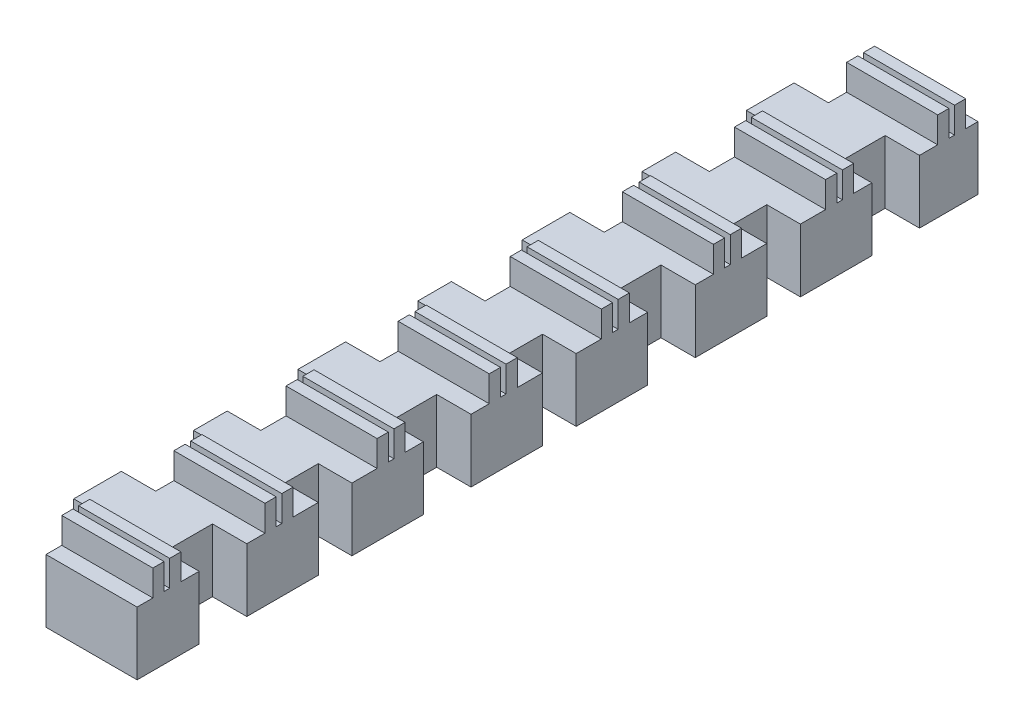
from build123d import *

# Parameters (mm, degrees)
SKETCH1_W           = 13
SKETCH1_H           = 120
BOSS_EXTRUDE1_DEPTH = 9
SKETCH2_W           = 4.9
SKETCH2_H           = 6.8
BOSS_EXTRUDE2_DEPTH = 9
LPATTERN1_COUNT     = 4
LPATTERN1_PITCH     = 32
SKETCH3_W           = 4.8
SKETCH3_H           = 4.8
BOSS_EXTRUDE3_DEPTH = 9
LPATTERN2_COUNT     = 3
LPATTERN2_PITCH     = 32
SKETCH4_R           = 1.5
CUT_EXTRUDE1_DEPTH  = 9.6
CUT_EXTRUDE2_START  = -9.6
SKETCH5_R           = 1.5
CUT_EXTRUDE2_DEPTH  = 9.6
SKETCH6_W           = 13
SKETCH6_H           = 1.6
BOSS_EXTRUDE4_DEPTH = 3.7
LPATTERN3_COUNT     = 8
LPATTERN3_PITCH     = 16
SKETCH7_W           = 4.9
SKETCH7_H           = 6.8
CUT_EXTRUDE3_DEPTH  = 9
SKETCH8_W           = 4.8
SKETCH8_H           = 4.8
CUT_EXTRUDE4_DEPTH  = 9
LPATTERN4_COUNT     = 4
LPATTERN4_PITCH     = 32
LPATTERN5_COUNT     = 3
LPATTERN5_PITCH     = 32


with BuildPart() as part:
    # Sketch1 → Boss-Extrude1 (new body)
    with BuildSketch(Plane(origin=(0, 0, 0), x_dir=(1, 0, 0), z_dir=(0, 1, 0))):
        Rectangle(SKETCH1_W, SKETCH1_H)
    extrude(amount=BOSS_EXTRUDE1_DEPTH)

    # Sketch2 → Boss-Extrude2 (add)
    with BuildSketch(Plane(origin=(0, 9, 0), x_dir=(1, 0, 0), z_dir=(0, 1, 0))):
        with Locations((-8.95, 48.25183578)):
            Rectangle(SKETCH2_W, SKETCH2_H)
    boss_extrude2 = extrude(amount=-BOSS_EXTRUDE2_DEPTH)

    # LPattern1: Boss-Extrude2 ×4
    with Locations(*[(0, 0, i * LPATTERN1_PITCH) for i in range(1, LPATTERN1_COUNT)]):
        add(boss_extrude2)

    # Sketch3 → Boss-Extrude3 (add)
    with BuildSketch(Plane(origin=(0, 9, 0), x_dir=(1, 0, 0), z_dir=(0, 1, 0))):
        with Locations((-8.9, 32.256443)):
            Rectangle(SKETCH3_W, SKETCH3_H)
    boss_extrude3 = extrude(amount=-BOSS_EXTRUDE3_DEPTH)

    # LPattern2: Boss-Extrude3 ×3
    with Locations(*[(0, 0, i * LPATTERN2_PITCH) for i in range(1, LPATTERN2_COUNT)]):
        add(boss_extrude3)

    # Sketch4 → Cut-Extrude1 (cut)
    with BuildSketch(Plane.XY.offset(51.14816422)):
        with Locations((-9.5, 3)):
            Circle(SKETCH4_R)
    extrude(amount=-CUT_EXTRUDE1_DEPTH, mode=Mode.SUBTRACT)

    # Sketch5 → Cut-Extrude2 (cut)
    with BuildSketch(Plane(origin=(0, 0, -51.65183578), x_dir=(-1, 0, 0), z_dir=(0, 0, -1)).offset(CUT_EXTRUDE2_START)):
        with Locations(Location((9.5, 3, 0), (0, 0, 180))):
            Circle(SKETCH5_R)
    extrude(amount=CUT_EXTRUDE2_DEPTH, mode=Mode.SUBTRACT)

    # Sketch6 → Boss-Extrude4 (add)
    with BuildSketch(Plane(origin=(0, 9, 0), x_dir=(1, 0, 0), z_dir=(0, 1, 0))):
        with Locations((0, 57.45)):
            Rectangle(SKETCH6_W, SKETCH6_H)
        with Locations((0, 55.05)):
            Rectangle(SKETCH6_W, SKETCH6_H)
    boss_extrude4 = extrude(amount=BOSS_EXTRUDE4_DEPTH)

    # LPattern3: Boss-Extrude4 ×8
    with Locations(*[(0, 0, i * LPATTERN3_PITCH) for i in range(1, LPATTERN3_COUNT)]):
        add(boss_extrude4)

    # Sketch7 → Cut-Extrude3 (cut)
    with BuildSketch(Plane(origin=(0, 9, 0), x_dir=(1, 0, 0), z_dir=(0, 1, 0))):
        with Locations((4.05, 48.25183578)):
            Rectangle(SKETCH7_W, SKETCH7_H)
    cut_extrude3 = extrude(amount=-CUT_EXTRUDE3_DEPTH, mode=Mode.SUBTRACT)

    # Sketch8 → Cut-Extrude4 (cut)
    with BuildSketch(Plane(origin=(0, 9, 0), x_dir=(1, 0, 0), z_dir=(0, 1, 0))):
        with Locations((4.1, 32.256443)):
            Rectangle(SKETCH8_W, SKETCH8_H)
    cut_extrude4 = extrude(amount=-CUT_EXTRUDE4_DEPTH, mode=Mode.SUBTRACT)

    # LPattern4: Cut-Extrude3 ×4
    with Locations(*[(0, 0, i * LPATTERN4_PITCH) for i in range(1, LPATTERN4_COUNT)]):
        add(cut_extrude3, mode=Mode.SUBTRACT)

    # LPattern5: Cut-Extrude4 ×3
    with Locations(*[(0, 0, i * LPATTERN5_PITCH) for i in range(1, LPATTERN5_COUNT)]):
        add(cut_extrude4, mode=Mode.SUBTRACT)


solid = part.part
